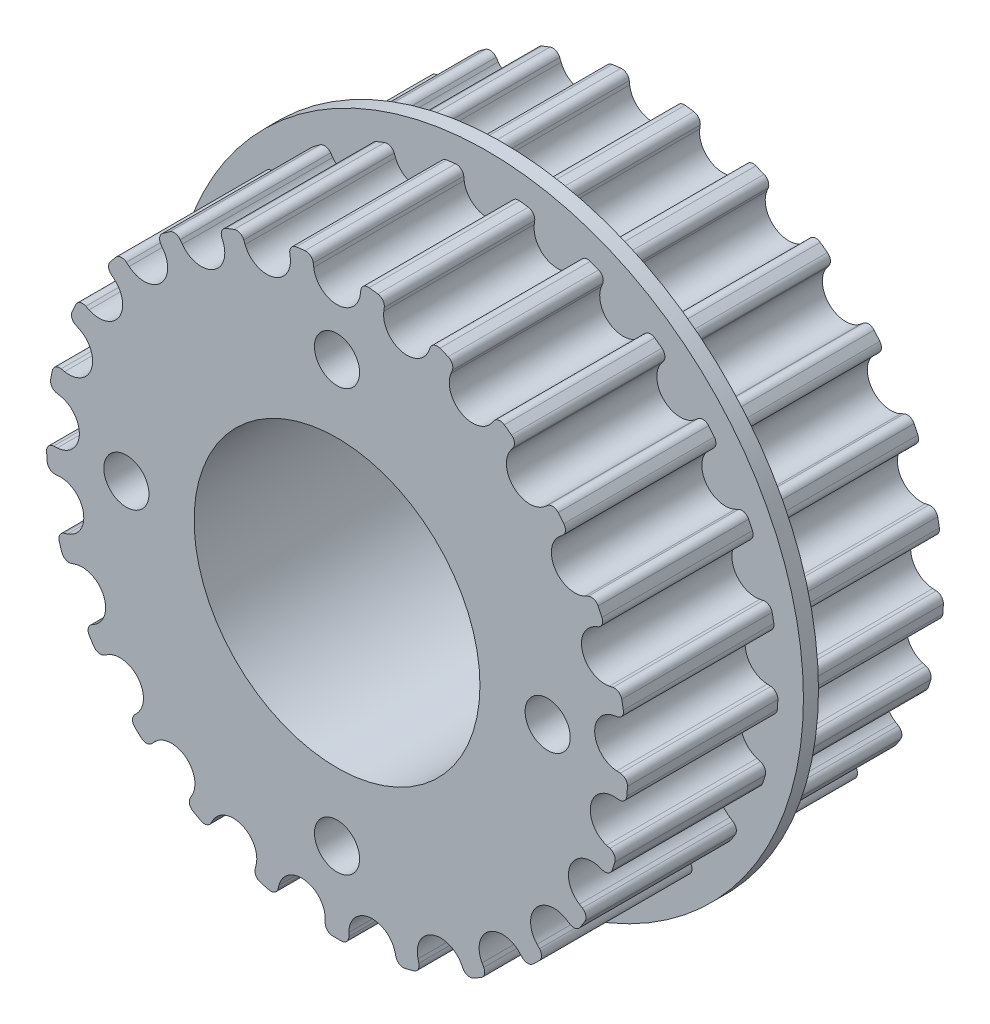
from build123d import *

# Parameters (mm, degrees)
SKETCH_1_R               = 19.894367886
EXTRUDE_1_DEPTH          = 21
CUT_EXTRUDE_1_DEPTH      = 36.108001185
PATTERN_CIRCULAR_1_COUNT = 25
EXTRUDE_START            = -10
SKETCH_3_R               = 21
EXTRUDE_2_DEPTH          = 1
CUT_EXTRUDE_2_REACH      = 38.373
SKETCH_4_R               = 9.5
CUT_EXTRUDE_3_REACH      = 38.373
SKETCH_5_R               = 1.5


with BuildPart() as part:
    # 草图1 → 凸台-拉伸1 (new body)
    with BuildSketch(Plane.XY):
        with Locations(Location((0, 0, 0), (0, 0, 180))):
            Circle(SKETCH_1_R)
    extrude(amount=EXTRUDE_1_DEPTH)

    # 草图2 → 切除-拉伸1 (cut, through all)
    with BuildSketch(Plane.XY.offset(21)):
        with BuildLine():
            Line((1.577407148, 18.768724044), (1.548371997, 18.532251711))
            ThreePointArc((1.548371997, 18.532251711), (0, 17.162367886), (-1.548371997, 18.532251711))
            Line((-1.548371997, 18.532251711), (-1.577407148, 18.768724044))
            ThreePointArc((-1.577407148, 18.768724044), (-1.763534561, 19.099975129), (-2.128765754, 19.204745692))
            ThreePointArc((-2.128765754, 19.204745692), (-2.275316606, 19.187934623), (-2.421734847, 19.170005244))
            Line((-2.421734847, 19.170005244), (-2.493425457, 19.737494854))
            ThreePointArc((-2.493425457, 19.737494854), (0, 19.894367886), (2.493425457, 19.737494854))
            Line((2.493425457, 19.737494854), (2.421734847, 19.170005244))
            ThreePointArc((2.421734847, 19.170005244), (2.275316606, 19.187934623), (2.128765754, 19.204745692))
            ThreePointArc((2.128765754, 19.204745692), (1.763534561, 19.099975129), (1.577407148, 18.768724044))
        make_face()
    cut_extrude_1 = extrude(amount=-CUT_EXTRUDE_1_DEPTH, mode=Mode.SUBTRACT)

    # 阵列(圆周)1: 切除-拉伸1 ×25 about axis
    pattern_circular_1_axis = Axis((0, 0, 0), (0, 0, 1))
    for i in range(1, PATTERN_CIRCULAR_1_COUNT):
        add(cut_extrude_1.rotate(pattern_circular_1_axis, i * 360 / PATTERN_CIRCULAR_1_COUNT), mode=Mode.SUBTRACT)

    # 草图3 → 凸台-拉伸2 (add)
    with BuildSketch(Plane.XY.offset(21).offset(EXTRUDE_START)):
        Circle(SKETCH_3_R)
    extrude(amount=-EXTRUDE_2_DEPTH)

    # 草图4 → 切除-拉伸2 (cut, up to next)
    with BuildSketch(Plane.XY.offset(21), mode=Mode.PRIVATE) as cut_extrude_2_sk1:
        Circle(SKETCH_4_R)
    cut_extrude_2_tool1 = extrude(cut_extrude_2_sk1.sketch, amount=-CUT_EXTRUDE_2_REACH, mode=Mode.PRIVATE) & part.part
    add(cut_extrude_2_tool1.solids().sort_by_distance((0, 0, 21))[0], mode=Mode.SUBTRACT)

    # 草图5 → 切除-拉伸3 (cut, up to next)
    with BuildSketch(Plane.XY.offset(21), mode=Mode.PRIVATE) as cut_extrude_3_sk1:
        with Locations((0, 14)):
            Circle(SKETCH_5_R)
    cut_extrude_3_tool1 = extrude(cut_extrude_3_sk1.sketch, amount=-CUT_EXTRUDE_3_REACH, mode=Mode.PRIVATE) & part.part
    # 草图5 → 切除-拉伸3 (cut, up to next)
    with BuildSketch(Plane.XY.offset(21), mode=Mode.PRIVATE) as cut_extrude_3_sk2:
        with Locations((14, 0)):
            Circle(SKETCH_5_R)
    cut_extrude_3_tool2 = extrude(cut_extrude_3_sk2.sketch, amount=-CUT_EXTRUDE_3_REACH, mode=Mode.PRIVATE) & part.part
    # 草图5 → 切除-拉伸3 (cut, up to next)
    with BuildSketch(Plane.XY.offset(21), mode=Mode.PRIVATE) as cut_extrude_3_sk3:
        with Locations((0, -14)):
            Circle(SKETCH_5_R)
    cut_extrude_3_tool3 = extrude(cut_extrude_3_sk3.sketch, amount=-CUT_EXTRUDE_3_REACH, mode=Mode.PRIVATE) & part.part
    # 草图5 → 切除-拉伸3 (cut, up to next)
    with BuildSketch(Plane.XY.offset(21), mode=Mode.PRIVATE) as cut_extrude_3_sk4:
        with Locations((-14, 0)):
            Circle(SKETCH_5_R)
    cut_extrude_3_tool4 = extrude(cut_extrude_3_sk4.sketch, amount=-CUT_EXTRUDE_3_REACH, mode=Mode.PRIVATE) & part.part
    add(cut_extrude_3_tool1.solids().sort_by_distance((0, 14, 21))[0], mode=Mode.SUBTRACT)
    add(cut_extrude_3_tool2.solids().sort_by_distance((14, 0, 21))[0], mode=Mode.SUBTRACT)
    add(cut_extrude_3_tool3.solids().sort_by_distance((0, -14, 21))[0], mode=Mode.SUBTRACT)
    add(cut_extrude_3_tool4.solids().sort_by_distance((-14, 0, 21))[0], mode=Mode.SUBTRACT)


solid = part.part
